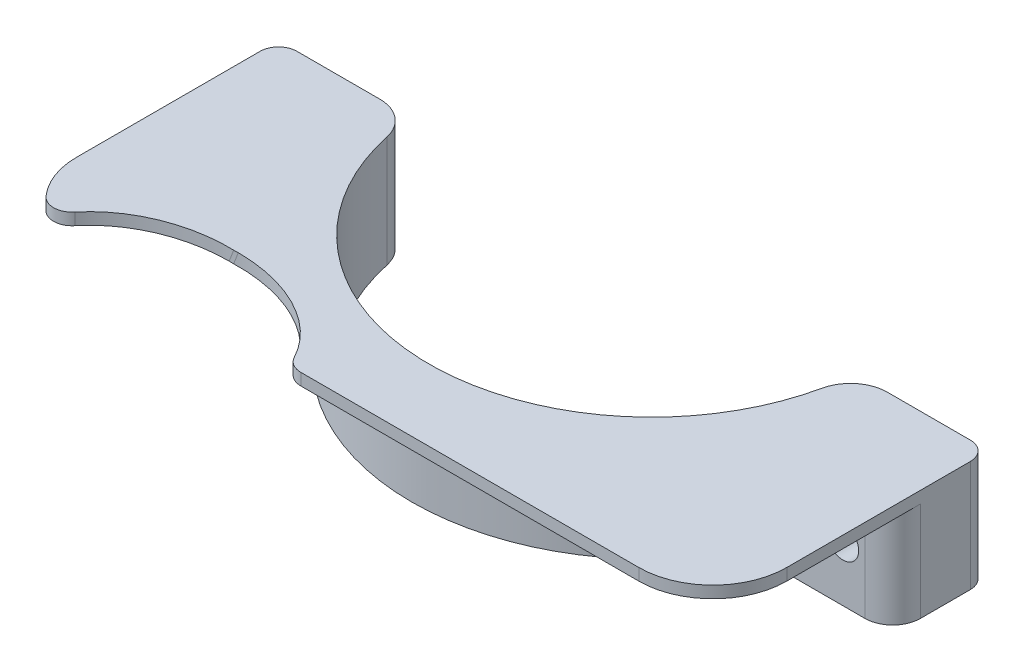
from build123d import *

# Parameters (mm, degrees)
BOSS_EXTRUDE1_DEPTH = 9.525
CUT_EXTRUDE1_DEPTH  = 8.509
SKETCH7_R           = 12.7
CUT_EXTRUDE5_DEPTH  = 311.3910907962684
SKETCH8_W           = 60.960000000000264
SKETCH8_H           = 4.881988708344636
CUT_EXTRUDE6_DEPTH  = 1619.9759805398598
FILLET1_R           = 1.5875
FILLET2_R           = 3.175
FILLET3_R           = 6.35
FILLET4_R           = 3.175
SKETCH3_R           = 1.3652500000001655
CUT_EXTRUDE2_DEPTH  = 1621.5886566924073
FILLET5_R           = 2.38125
SKETCH4_R           = 8.73125
CUT_EXTRUDE3_DEPTH  = 240.4698945629162
CUT_EXTRUDE4_DEPTH  = 1619.970321846883
FILLET6_R           = 1.5875


with BuildPart() as part:
    # Sketch1 → Boss-Extrude1 (new body)
    with BuildSketch(Plane(origin=(0, 163.5766009306779, 0), x_dir=(1, 0, 0), z_dir=(0, 1, 0))):
        with BuildLine():
            Line((1551.1779999999999, 148.33599999999998), (1551.1779999999999, 119.761))
            Line((1551.1779999999999, 119.761), (1612.1380000000001, 119.761))
            Line((1612.1380000000001, 119.761), (1612.1380000000001, 148.33599999999998))
            Line((1612.1380000000001, 148.33599999999998), (1600.697905058587, 148.33599999999998))
            ThreePointArc((1600.697905058587, 148.33599999999998), (1581.658, 130.75920000000005), (1562.6180949414131, 148.33599999999998))
            Line((1562.6180949414131, 148.33599999999998), (1551.1779999999999, 148.33599999999998))
        make_face()
    extrude(amount=-BOSS_EXTRUDE1_DEPTH)

    # Sketch2 → Cut-Extrude1 (cut)
    with BuildSketch(Plane.XZ.offset(-154.0516009306779)):
        with BuildLine():
            Line((1563.5566012971371, -140.08100000000002), (1551.1779999999999, -140.081))
            Line((1551.1779999999999, -140.081), (1551.1779999999999, -119.761))
            Line((1551.1779999999999, -119.761), (1612.1380000000001, -119.761))
            Line((1612.1380000000001, -119.761), (1612.1380000000001, -140.081))
            Line((1612.1380000000001, -140.081), (1599.7593987028629, -140.08099999999996))
            ThreePointArc((1599.7593987028629, -140.08099999999996), (1581.658, -129.28599999999975), (1563.5566012971371, -140.08100000000002))
        make_face()
    extrude(amount=-CUT_EXTRUDE1_DEPTH, mode=Mode.SUBTRACT)

    # Sketch7 → Cut-Extrude5 (cut, through all)
    with BuildSketch(Plane(origin=(1303.637754694049, 176.0226009306779, -122.11572061809383), x_dir=(9e-17, 0, 1), z_dir=(-1, 0, 9e-17))):
        Circle(SKETCH7_R)
    extrude(amount=-CUT_EXTRUDE5_DEPTH, mode=Mode.SUBTRACT)

    # Sketch8 → Cut-Extrude6 (cut, through all)
    with BuildSketch(Plane(origin=(0, 163.5766009306779, 0), x_dir=(1, 0, 0), z_dir=(0, 1, 0))):
        with Locations((1581.658, 122.2019943541723)):
            Rectangle(SKETCH8_W, SKETCH8_H)
    extrude(amount=-CUT_EXTRUDE6_DEPTH, mode=Mode.SUBTRACT)

    # Fillet1
    fillet1_edges = [part.edges().sort_by_distance(p)[0] for p in [
        (1612.1380000000001, 158.8141009306779, -148.33599999999998),
        (1551.1779999999999, 158.8141009306779, -148.33599999999998),
    ]]
    fillet(fillet1_edges, radius=FILLET1_R)

    # Fillet2
    fillet2_edges = [part.edges().sort_by_distance(p)[0] for p in [
        (1562.6180949414133, 158.8141009306779, -148.33599999999998),
        (1600.697905058587, 158.8141009306779, -148.33599999999998),
    ]]
    fillet(fillet2_edges, radius=FILLET2_R)

    # Fillet3
    fillet3_edges = [part.edges().sort_by_distance(p)[0] for p in [
        (1551.1779999999999, 163.0686009306779, -124.64298870834462),
        (1612.1380000000001, 163.0686009306779, -124.64298870834462),
    ]]
    fillet(fillet3_edges, radius=FILLET3_R)

    # Fillet4
    fillet4_edges = [part.edges().sort_by_distance(p)[0] for p in [
        (1563.5566012971371, 158.3061009306779, -140.081),
        (1599.7593987028629, 158.3061009306779, -140.081),
    ]]
    fillet(fillet4_edges, radius=FILLET4_R)

    # Sketch3 → Cut-Extrude2 (cut, through all)
    with BuildSketch(Plane(origin=(0, 0, -148.33599999999998), x_dir=(-1, 0, 0), z_dir=(0, 0, -1))):
        with Locations((-1607.85175, 158.81410093067788)):
            Circle(SKETCH3_R)
        with Locations((-1555.46425, 158.81410093067788)):
            Circle(SKETCH3_R)
    extrude(amount=-CUT_EXTRUDE2_DEPTH, mode=Mode.SUBTRACT)

    # Fillet5
    fillet5_edges = [part.edges().sort_by_distance(p)[0] for p in [
        (1612.1380000000001, 158.3061009306779, -140.081),
        (1551.1779999999999, 158.3061009306779, -140.081),
    ]]
    fillet(fillet5_edges, radius=FILLET5_R)

    # Sketch4 → Cut-Extrude3 (cut, through all)
    with BuildSketch(Plane(origin=(1439.2188773470248, 0, -122.11572061809389), x_dir=(0.7922342218401738, -0.6102171234448396, 0), z_dir=(0.6102171234448396, 0.7922342218401738, 0))):
        Circle(SKETCH4_R)
    extrude(amount=CUT_EXTRUDE3_DEPTH, mode=Mode.SUBTRACT)

    # Sketch5 → Cut-Extrude4 (cut, through all)
    with BuildSketch(Plane.XZ.offset(-162.5606009306779)):
        with BuildLine():
            Line((1575.7627555434017, -124.64298870834462), (1554.288296988747, -124.64298870834462))
            Line((1554.288296988747, -124.64298870834462), (1554.288296988747, -125.5315947105746))
            add(Edge.make_bspline(
                [(1554.288296988747, -125.5315947105746), (1557.2518633463235, -131.0545321778698), (1564.8222025264909, -130.8414660061513)],
                knots=[0.40196116798680276, 0.40196116798680276, 0.40196116798680276, 1.6063073314676504, 1.6063073314676504, 1.6063073314676504], degree=2, weights=[1, 0.8241066528926729, 1]))
            add(Edge.make_bspline(
                [(1564.8222025264909, -130.8414660061513), (1573.3056616651588, -131.08023181552778), (1575.7627555434017, -124.64298870834462)],
                knots=[1.5352853221221223, 1.5352853221221223, 1.5352853221221223, 2.847939531851077, 2.847939531851077, 2.847939531851077], degree=2, weights=[1, 0.7922388117830882, 1]))
        make_face()
    extrude(amount=-CUT_EXTRUDE4_DEPTH, mode=Mode.SUBTRACT)

    # Fillet6
    fillet6_edges = [part.edges().sort_by_distance(p)[0] for p in [
        (1575.7627555434017, 163.06860093067792, -124.64298870834462),
        (1554.288296988747, 163.06860093067792, -125.5315947105746),
    ]]
    fillet(fillet6_edges, radius=FILLET6_R)


solid = part.part
